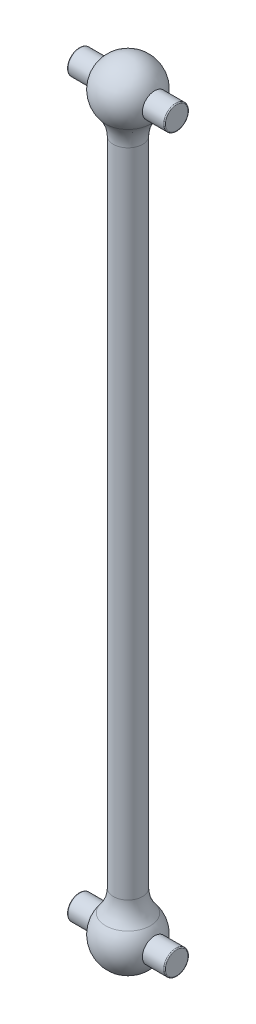
from build123d import *

# Parameters (mm, degrees)
SKETCH1_R            = 1.905
BOSS_EXTRUDE1_DEPTH  = 47.625
SKETCH3_R            = 1.5875
BOSS_EXTRUDE2_DEPTH  = 6.35
FILLET1_R            = 0.127
FILLET1_OF_MIRROR1_R = 0.127


with BuildPart() as part:
    # Sketch1 → Boss-Extrude1 (new body)
    with BuildSketch(Plane(origin=(0, 0, 0), x_dir=(1, 0, 0), z_dir=(0, 1, 0))):
        with Locations(Location((0, 0, 0), (0, 0, 270))):
            Circle(SKETCH1_R)
    boss_extrude1 = extrude(amount=BOSS_EXTRUDE1_DEPTH)

    # Sketch2 → Revolve2 (revolve)
    with BuildSketch(Plane.XY, mode=Mode.PRIVATE) as revolve2_sk:
        with BuildLine():
            Line((1.905, 42.391055516), (0, 42.391055516))
            Line((0, 42.391055516), (0, 51.435))
            ThreePointArc((0, 51.435), (3.453032669, 49.235175577), (2.918629328, 45.175979207))
            ThreePointArc((2.918629328, 45.175979207), (2.166286071, 43.872882461), (1.905, 42.391055516))
        make_face()
    revolve2 = revolve(revolve2_sk.sketch.rotate(Axis((0, 51.435, 0), (0, -1, 0)), 180), axis=Axis((0, 51.435, 0), (0, -1, 0)))

    # Sketch3 → Boss-Extrude2 (add, symmetric)
    with BuildSketch(Plane(origin=(0, 0, 0), x_dir=(0, 0, -1), z_dir=(1, 0, 0))):
        with Locations(Location((0, 47.625, 0), (0, 0, 180))):
            Circle(SKETCH3_R)
    boss_extrude2 = extrude(amount=BOSS_EXTRUDE2_DEPTH, both=True)

    # Fillet1
    fillet1_edges = [part.edges().sort_by_distance(p)[0] for p in [
        (-6.35, 47.625, -1.5875),
        (6.35, 47.625, -1.5875),
    ]]
    fillet(fillet1_edges, radius=FILLET1_R)

    # Mirror1: Boss-Extrude1, Revolve2, Boss-Extrude2 across Top Plane
    add(boss_extrude1.mirror(Plane(origin=(0, 0, 0), x_dir=(1, 0, 0), z_dir=(0, 1, 0))))
    add(revolve2.mirror(Plane(origin=(0, 0, 0), x_dir=(1, 0, 0), z_dir=(0, 1, 0))))
    add(boss_extrude2.mirror(Plane(origin=(0, 0, 0), x_dir=(1, 0, 0), z_dir=(0, 1, 0))))

    # Fillet1 of Mirror1
    fillet1_of_mirror1_edges = [part.edges().sort_by_distance(p)[0] for p in [
        (-6.35, -47.625, -1.5875),
        (6.35, -47.625, -1.5875),
    ]]
    fillet(fillet1_of_mirror1_edges, radius=FILLET1_OF_MIRROR1_R)


solid = part.part
